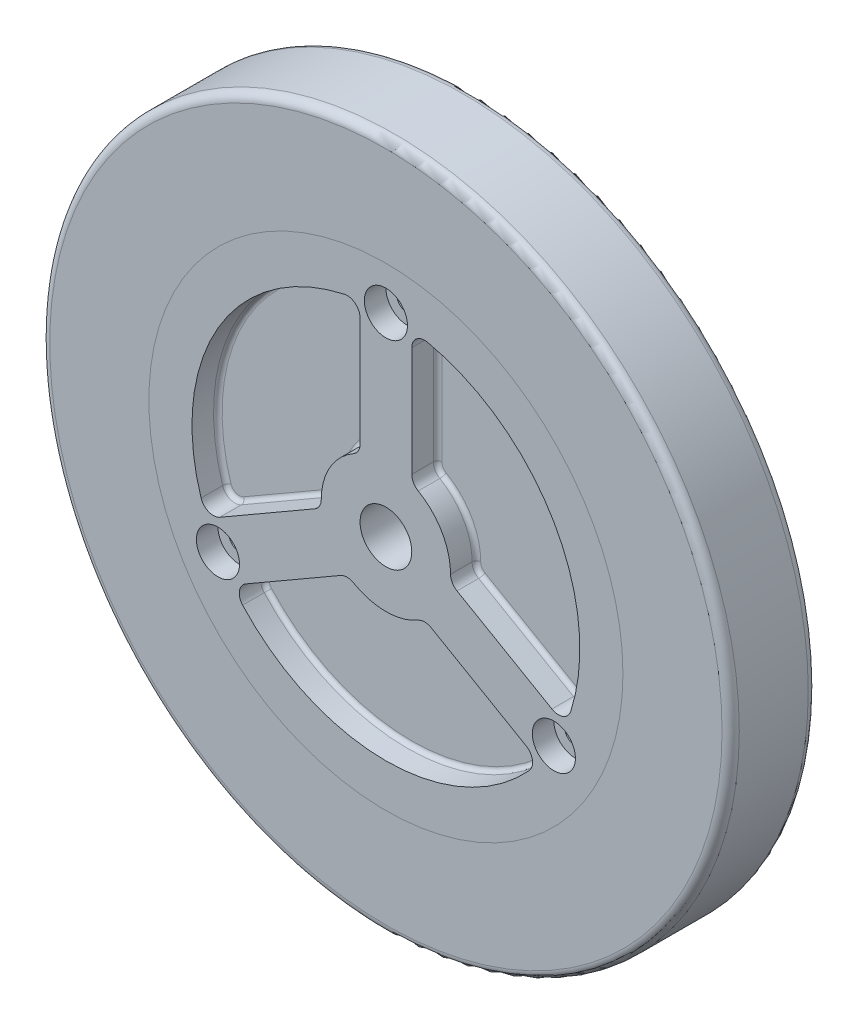
from build123d import *

# Parameters (mm, degrees)
SKETCH_1_R               = 55
EXTRUDE_1_DEPTH          = 20
SKETCH_2_R               = 2.65
CUT_EXTRUDE_1_DEPTH      = 81.311892021
SKETCH_11_R              = 6
CUT_EXTRUDE_6_DEPTH      = 15
SKETCH_3_R               = 2.5
CUT_EXTRUDE_2_DEPTH      = 81.311892021
SKETCH_5_R               = 5
CUT_EXTRUDE_3_DEPTH      = 5
PATTERN_CIRCULAR_1_COUNT = 3
SKETCH_6_R               = 2
CUT_EXTRUDE_4_DEPTH      = 10
SKETCH_7_R               = 80
SKETCH_7_R_2             = 55
EXTRUDE_2_DEPTH          = 20
FILLET_1_R               = 2
CUT_EXTRUDE_5_DEPTH      = 6
FILLET_2_R               = 1


with BuildPart() as part:
    # 草图1 → 凸台-拉伸1 (new body)
    with BuildSketch(Plane.XY):
        Circle(SKETCH_1_R)
    extrude(amount=EXTRUDE_1_DEPTH)

    # 草图2 → 切除-拉伸1 (cut, through all)
    with BuildSketch(Plane.XY.offset(20)):
        Circle(SKETCH_2_R)
    extrude(amount=-CUT_EXTRUDE_1_DEPTH, mode=Mode.SUBTRACT)

    # 草图11 → 切除-拉伸6 (cut)
    with BuildSketch(Plane.XY.offset(20)):
        Circle(SKETCH_11_R)
    extrude(amount=-CUT_EXTRUDE_6_DEPTH, mode=Mode.SUBTRACT)

    # 草图3 → 切除-拉伸2 (cut, through all)
    with BuildSketch(Plane.XY.offset(20)):
        with Locations((0, 45)):
            Circle(SKETCH_3_R)
        with Locations((38.97114317, -22.5)):
            Circle(SKETCH_3_R)
        with Locations((-38.97114317, -22.5)):
            Circle(SKETCH_3_R)
    extrude(amount=-CUT_EXTRUDE_2_DEPTH, mode=Mode.SUBTRACT)

    # 草图5 → 切除-拉伸3 (cut)
    with BuildSketch(Plane.XY.offset(20)):
        with Locations((0, 45)):
            Circle(SKETCH_5_R)
    cut_extrude_3 = extrude(amount=-CUT_EXTRUDE_3_DEPTH, mode=Mode.SUBTRACT)

    # 阵列(圆周)1: 切除-拉伸3 ×3 about axis
    pattern_circular_1_axis = Axis((0, 0, 0), (0, 0, 1))
    for i in range(1, PATTERN_CIRCULAR_1_COUNT):
        add(cut_extrude_3.rotate(pattern_circular_1_axis, i * 360 / PATTERN_CIRCULAR_1_COUNT), mode=Mode.SUBTRACT)

    # 草图6 → 切除-拉伸4 (cut)
    with BuildSketch(Plane.XY):
        with Locations((0, 30)):
            Circle(SKETCH_6_R)
        with Locations((25.980762114, -15)):
            Circle(SKETCH_6_R)
        with Locations((-25.980762114, -15)):
            Circle(SKETCH_6_R)
    extrude(amount=CUT_EXTRUDE_4_DEPTH, mode=Mode.SUBTRACT)

    # 草图9 → 切除-拉伸5 (cut)
    with BuildSketch(Plane.XY.offset(20)):
        with BuildLine():
            Line((-6, 41.024382994), (-6, 15.588457268))
            ThreePointArc((-6, 15.588457268), (-6.401923789, 14.088457268), (-7.5, 12.990381057))
            ThreePointArc((-7.5, 12.990381057), (-12.990381057, 7.5), (-15, 0))
            ThreePointArc((-15, 0), (-15.401923789, -1.5), (-16.5, -2.598076211))
            Line((-16.5, -2.598076211), (-38.528157847, -15.316039074))
            ThreePointArc((-38.528157847, -15.316039074), (-41.112387766, -15.515183891), (-42.887311979, -13.626388781))
            ThreePointArc((-42.887311979, -13.626388781), (-38.97114317, 22.5), (-9.642857143, 43.954696064))
            ThreePointArc((-9.642857143, 43.954696064), (-7.119650488, 43.361964161), (-6, 41.024382994))
        make_face()
        with BuildLine():
            Line((6, 41.024382994), (6, 15.588457268))
            ThreePointArc((6, 15.588457268), (6.401923789, 14.088457268), (7.5, 12.990381057))
            ThreePointArc((7.5, 12.990381057), (12.990381057, 7.5), (15, 0))
            ThreePointArc((15, 0), (15.401923789, -1.5), (16.5, -2.598076211))
            Line((16.5, -2.598076211), (38.528157847, -15.316039074))
            ThreePointArc((38.528157847, -15.316039074), (41.112387766, -15.515183891), (42.887311979, -13.626388781))
            ThreePointArc((42.887311979, -13.626388781), (38.97114317, 22.5), (9.642857143, 43.954696064))
            ThreePointArc((9.642857143, 43.954696064), (7.119650488, 43.361964161), (6, 41.024382994))
        make_face()
        with BuildLine():
            Line((32.528157847, -25.708343919), (10.5, -12.990381057))
            ThreePointArc((10.5, -12.990381057), (9, -12.588457268), (7.5, -12.990381057))
            ThreePointArc((7.5, -12.990381057), (0, -15), (-7.5, -12.990381057))
            ThreePointArc((-7.5, -12.990381057), (-9, -12.588457268), (-10.5, -12.990381057))
            Line((-10.5, -12.990381057), (-32.528157847, -25.708343919))
            ThreePointArc((-32.528157847, -25.708343919), (-33.992737277, -27.84678027), (-33.244454836, -30.328307283))
            ThreePointArc((-33.244454836, -30.328307283), (0, -45), (33.244454836, -30.328307283))
            ThreePointArc((33.244454836, -30.328307283), (33.992737277, -27.84678027), (32.528157847, -25.708343919))
        make_face()
    cut_extrude_5 = extrude(amount=-CUT_EXTRUDE_5_DEPTH, mode=Mode.SUBTRACT)

    # 镜向1: 切除-拉伸5 across plane
    add(cut_extrude_5.mirror(Plane.XY.offset(10)), mode=Mode.SUBTRACT)

    # 圆角2
    fillet_2_edges = [part.edges().sort_by_distance(p)[0] for p in [
        (-6.401923789, 14.088457268, 6),
        (-6, 28.306420131, 6),
        (-7.119650488, 43.361964161, 6),
        (-38.97114317, 22.5, 6),
        (-41.112387766, -15.515183891, 6),
        (-27.514078923, -8.957057643, 6),
        (-15.401923789, -1.5, 6),
        (-12.990381057, 7.5, 6),
        (6.401923789, 14.088457268, 6),
        (12.990381057, 7.5, 6),
        (15.401923789, -1.5, 6),
        (27.514078923, -8.957057643, 6),
        (41.112387766, -15.515183891, 6),
        (38.97114317, 22.5, 6),
        (7.119650488, 43.361964161, 6),
        (6, 28.306420131, 6),
        (-9, -12.588457268, 6),
        (-21.514078923, -19.349362488, 6),
        (-33.992737277, -27.84678027, 6),
        (0, -45, 6),
        (33.992737277, -27.84678027, 6),
        (21.514078923, -19.349362488, 6),
        (9, -12.588457268, 6),
        (0, -15, 6),
        (-6.401923789, 14.088457268, 14),
        (-12.990381057, 7.5, 14),
        (-15.401923789, -1.5, 14),
        (-27.514078923, -8.957057643, 14),
        (-41.112387766, -15.515183891, 14),
        (-38.97114317, 22.5, 14),
        (-7.119650488, 43.361964161, 14),
        (-6, 28.306420131, 14),
        (6.401923789, 14.088457268, 14),
        (6, 28.306420131, 14),
        (7.119650488, 43.361964161, 14),
        (38.97114317, 22.5, 14),
        (41.112387766, -15.515183891, 14),
        (27.514078923, -8.957057643, 14),
        (15.401923789, -1.5, 14),
        (12.990381057, 7.5, 14),
        (-9, -12.588457268, 14),
        (0, -15, 14),
        (9, -12.588457268, 14),
        (21.514078923, -19.349362488, 14),
        (33.992737277, -27.84678027, 14),
        (0, -45, 14),
        (-33.992737277, -27.84678027, 14),
        (-21.514078923, -19.349362488, 14),
    ]]
    fillet(fillet_2_edges, radius=FILLET_2_R)


with BuildPart() as body_2:
    # 草图7 → 凸台-拉伸2 (new body)
    with BuildSketch(Plane.XY):
        Circle(SKETCH_7_R)
        Circle(SKETCH_7_R_2, mode=Mode.SUBTRACT)
    extrude(amount=EXTRUDE_2_DEPTH)

    # 圆角1
    fillet_1_edges = [body_2.edges().sort_by_distance(p)[0] for p in [
        (-80, 0, 20),
        (-80, 0, 0),
    ]]
    fillet(fillet_1_edges, radius=FILLET_1_R)


solid = Compound([part.part, body_2.part])
